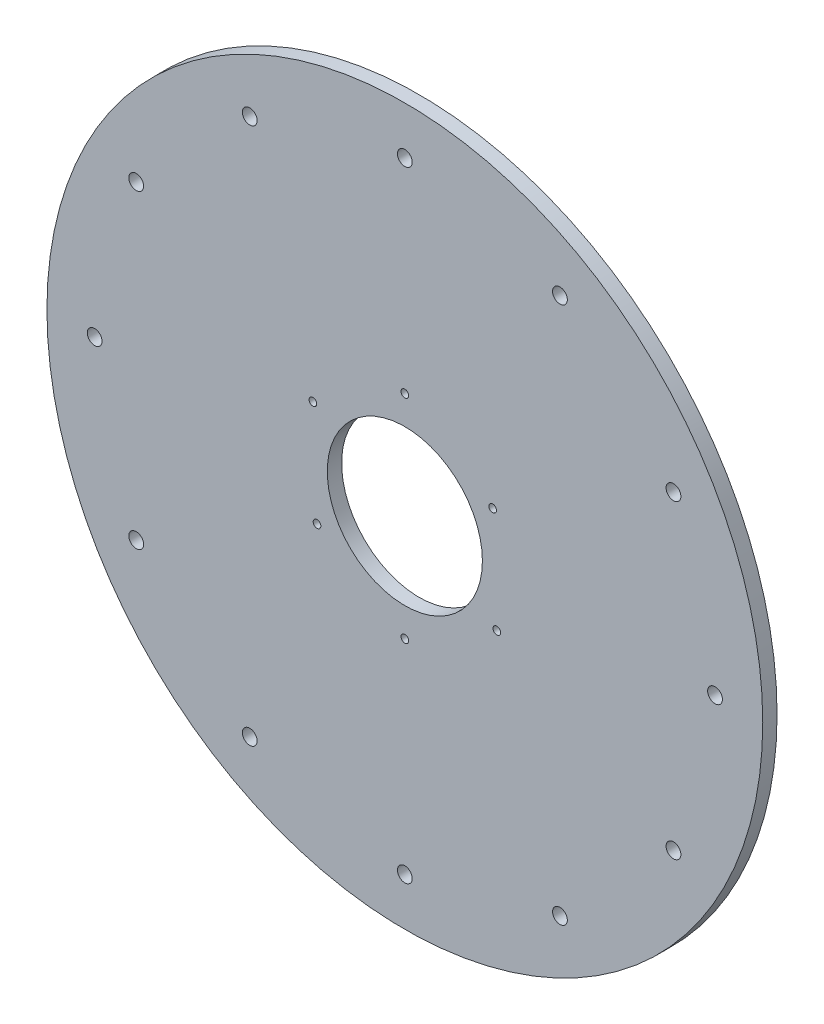
from build123d import *

# Parameters (mm, degrees)
SKETCH_1_R      = 150
SKETCH_1_R_2    = 32.5
SKETCH_1_R_3    = 3.1
SKETCH_1_R_4    = 1.6
EXTRUDE_1_DEPTH = 6


with BuildPart() as part:
    # 草图1 → 凸台-拉伸1 (new body)
    with BuildSketch(Plane.XY):
        Circle(SKETCH_1_R)
        Circle(SKETCH_1_R_2, mode=Mode.SUBTRACT)
        with Locations((0, 130)):
            Circle(SKETCH_1_R_3, mode=Mode.SUBTRACT)
        with Locations((65, 112.583302492)):
            Circle(SKETCH_1_R_3, mode=Mode.SUBTRACT)
        with Locations((112.583302492, 65)):
            Circle(SKETCH_1_R_3, mode=Mode.SUBTRACT)
        with Locations((130, 0)):
            Circle(SKETCH_1_R_3, mode=Mode.SUBTRACT)
        with Locations((112.583302492, -65)):
            Circle(SKETCH_1_R_3, mode=Mode.SUBTRACT)
        with Locations((65, -112.583302492)):
            Circle(SKETCH_1_R_3, mode=Mode.SUBTRACT)
        with Locations((0, -130)):
            Circle(SKETCH_1_R_3, mode=Mode.SUBTRACT)
        with Locations((-65, -112.583302492)):
            Circle(SKETCH_1_R_3, mode=Mode.SUBTRACT)
        with Locations((-112.583302492, -65)):
            Circle(SKETCH_1_R_3, mode=Mode.SUBTRACT)
        with Locations((-130, 0)):
            Circle(SKETCH_1_R_3, mode=Mode.SUBTRACT)
        with Locations((-112.583302492, 65)):
            Circle(SKETCH_1_R_3, mode=Mode.SUBTRACT)
        with Locations((-65, 112.583302492)):
            Circle(SKETCH_1_R_3, mode=Mode.SUBTRACT)
        with Locations((0, 44.5)):
            Circle(SKETCH_1_R_4, mode=Mode.SUBTRACT)
        with Locations((38.538130468, -22.25)):
            Circle(SKETCH_1_R_4, mode=Mode.SUBTRACT)
        with Locations((0, -44.5)):
            Circle(SKETCH_1_R_4, mode=Mode.SUBTRACT)
        with Locations((-38.538130468, 22.25)):
            Circle(SKETCH_1_R_4, mode=Mode.SUBTRACT)
        with Locations((36.806829661, 21.250433013)):
            Circle(SKETCH_1_R_4, mode=Mode.SUBTRACT)
        with Locations(Location((-36.805329661, -21.249566987, 0), (0, 0, 180))):
            Circle(SKETCH_1_R_4, mode=Mode.SUBTRACT)
    extrude(amount=EXTRUDE_1_DEPTH)


solid = part.part
